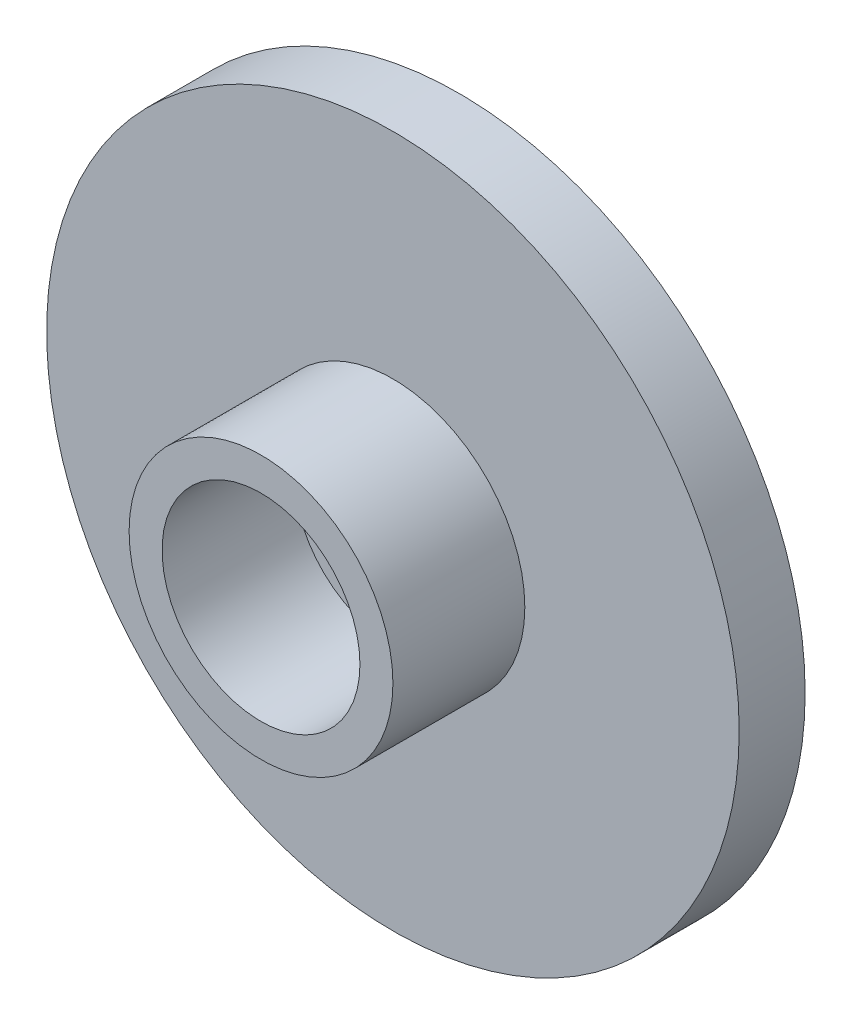
from build123d import *


with BuildPart() as part:
    # 草图1 → 旋转1 (revolve)
    with BuildSketch(Plane(origin=(0, 0, 0), x_dir=(1, 0, 0), z_dir=(0, 1, 0))):
        Polygon((10.5, 0), (0, 0), (0, -2), (3, -2), (3, -6), (4, -6), (4, -2), (10.5, -2), align=None)
    revolve(axis=Axis((0, 0, 0), (0, 0, 1)))


solid = part.part
